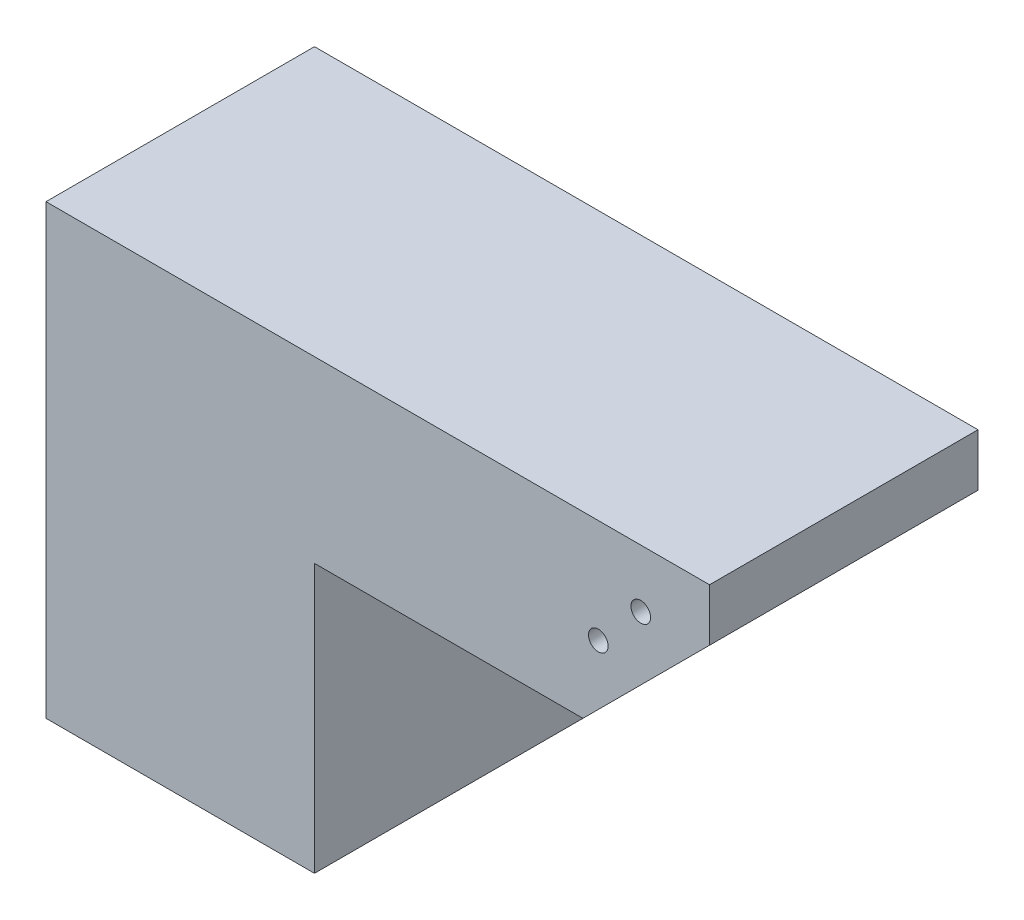
from build123d import *

# Parameters (mm, degrees)
BOSS_EXTRUDE1_DEPTH = 15
SKETCH2_W           = 23.7
SKETCH2_H           = 23.7
CUT_EXTRUDE1_DEPTH  = 26
SKETCH5_W           = 12.2
SKETCH5_H           = 12.2
CUT_EXTRUDE3_DEPTH  = 10.4
SKETCH6_R           = 1.1
CUT_EXTRUDE4_DEPTH  = 84.052948209
SKETCH7_R           = 1.1
CUT_EXTRUDE5_DEPTH  = 84.052948209


with BuildPart() as part:
    # Sketch1 → Boss-Extrude1 (new, symmetric)
    with BuildSketch(Plane.XY):
        Polygon((0, 0), (15, 0), (15, 30), (45, 30), (59.142135624, 44.142135624), (59.142135624, 50), (-15, 50), (-15, 0), align=None)
    extrude(amount=BOSS_EXTRUDE1_DEPTH, both=True)

    # Sketch2 → Cut-Extrude1 (cut)
    with BuildSketch(Plane.XZ):
        Rectangle(SKETCH2_W, SKETCH2_H)
    extrude(amount=-CUT_EXTRUDE1_DEPTH, mode=Mode.SUBTRACT)

    # Sketch5 → Cut-Extrude3 (cut)
    with BuildSketch(Plane(origin=(7.5, -7.5, 0), x_dir=(0, 0, -1), z_dir=(0.7071067811865487, -0.7071067811865465, 0))):
        with Locations((0, 63.033008589)):
            Rectangle(SKETCH5_W, SKETCH5_H)
    extrude(amount=-CUT_EXTRUDE3_DEPTH, mode=Mode.SUBTRACT)

    # Sketch6 → Cut-Extrude4 (cut, through all)
    with BuildSketch(Plane.XY.offset(15)):
        with Locations((51.46, 43.54)):
            Circle(SKETCH6_R)
    extrude(amount=-CUT_EXTRUDE4_DEPTH, mode=Mode.SUBTRACT)

    # Sketch7 → Cut-Extrude5 (cut, through all)
    with BuildSketch(Plane.XY.offset(15)):
        with Locations((46.714373567, 38.394222143)):
            Circle(SKETCH7_R)
    extrude(amount=-CUT_EXTRUDE5_DEPTH, mode=Mode.SUBTRACT)


solid = part.part
